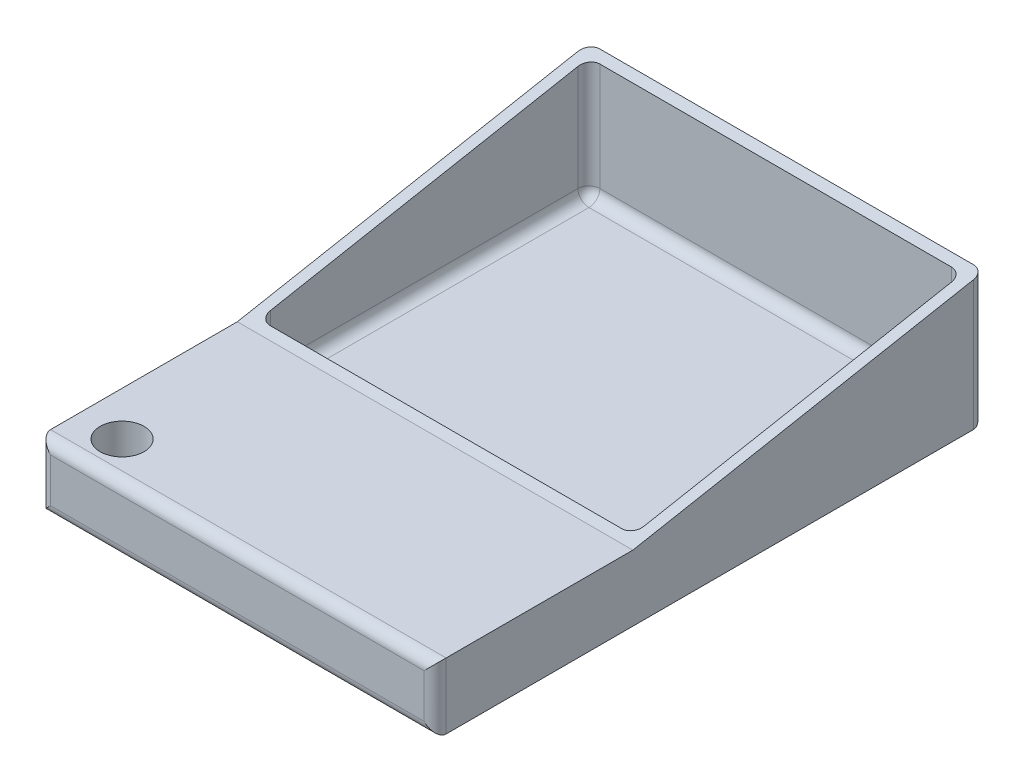
from build123d import *

# Parameters (mm, degrees)
BOSS_EXTRUDE1_DEPTH    = 90
SHELL1_T               = -2.5
SKETCH2_W              = 90
SKETCH2_H              = 45
BOSS_EXTRUDE2_DEPTH    = 15
F_10_0MM_DOWEL_HOLE1_D = 10
FILLET1_R              = 2.5


with BuildPart() as part:
    # Sketch1 → Boss-Extrude1 (new body)
    with BuildSketch(Plane(origin=(0, 0, 0), x_dir=(0, 0, -1), z_dir=(1, 0, 0))):
        Polygon((0, 0), (80, 0), (80, 30), (0, 15), align=None)
    extrude(amount=BOSS_EXTRUDE1_DEPTH)

    # Shell1
    shell1_openings = [part.faces().sort_by_distance(p)[0] for p in [
        (45, 22.5, -40),
    ]]
    offset(amount=SHELL1_T, openings=shell1_openings, kind=Kind.INTERSECTION)

    # Sketch2 → Boss-Extrude2 (add)
    with BuildSketch(Plane.XZ):
        with Locations((45, 22.5)):
            Rectangle(SKETCH2_W, SKETCH2_H)
    extrude(amount=-BOSS_EXTRUDE2_DEPTH)

    # Ø10.0mm Dowel Hole1 (through all)
    with Locations(Plane.XZ):
        with Locations((10, 36.22)):
            Hole(F_10_0MM_DOWEL_HOLE1_D / 2)

    # Fillet1
    fillet1_edges = [part.edges().sort_by_distance(p)[0] for p in [
        (90, 15, -80),
        (2.5, 8.984375, -2.5),
        (2.5, 2.5, -40),
        (45, 2.5, -2.5),
        (2.5, 16.015625, -77.5),
        (45, 2.5, -77.5),
        (87.5, 8.984375, -2.5),
        (87.5, 2.5, -40),
        (87.5, 16.015625, -77.5),
        (45, 15, 45),
        (0, 7.5, 45),
        (90, 7.5, 45),
        (45, 0, 45),
        (0, 15, -80),
        (45, 0, -80),
    ]]
    fillet(fillet1_edges, radius=FILLET1_R)


solid = part.part
